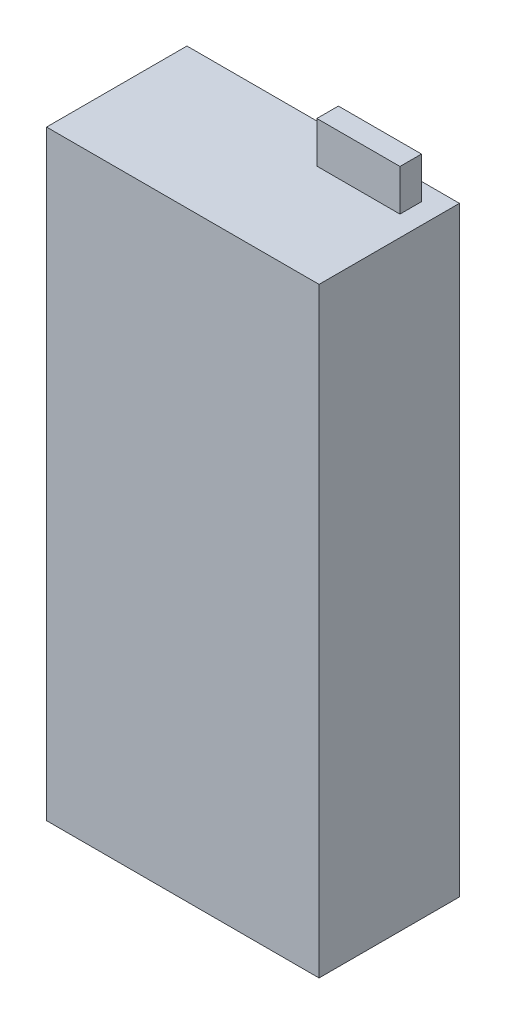
from build123d import *

# Parameters (mm, degrees)
SKETCH_1_W          = 132
SKETCH_1_H          = 291
EXTRUDE_1_DEPTH     = 68
SKETCH_2_R          = 2
CUT_EXTRUDE_1_DEPTH = 4
SKETCH_3_W          = 53.053280534
SKETCH_3_H          = 10.202175613
EXTRUDE_2_DEPTH     = 20
SKETCH_4_R          = 24.120605075
EXTRUDE_3_DEPTH     = 5
SKETCH_5_W          = 40.253809201
SKETCH_5_H          = 10.422389964
EXTRUDE_4_DEPTH     = 20


with BuildPart() as part:
    # 草图1 → 凸台-拉伸1 (new body)
    with BuildSketch(Plane.XY):
        with Locations((-127.074626866, 141.649253731)):
            Rectangle(SKETCH_1_W, SKETCH_1_H)
    extrude(amount=EXTRUDE_1_DEPTH)

    # 草图2 → 切除-拉伸1 (cut)
    with BuildSketch(Plane.ZY.offset(193.074626866)):
        with Locations(Location((17.5, 23.149253731, 0), (0, 0, 270))):
            Circle(SKETCH_2_R)
        with Locations(Location((55.5, 23.149253731, 0), (0, 0, 270))):
            Circle(SKETCH_2_R)
        with Locations(Location((55.5, 33.149253731, 0), (0, 0, 270))):
            Circle(SKETCH_2_R)
        with Locations(Location((17.5, 33.149253731, 0), (0, 0, 270))):
            Circle(SKETCH_2_R)
        with Locations(Location((17.5, 269.449253731, 0), (0, 0, 90))):
            Circle(SKETCH_2_R)
        with Locations(Location((17.5, 259.449253731, 0), (0, 0, 90))):
            Circle(SKETCH_2_R)
        with Locations(Location((55.5, 259.449253731, 0), (0, 0, 90))):
            Circle(SKETCH_2_R)
        with Locations(Location((55.5, 269.449253731, 0), (0, 0, 90))):
            Circle(SKETCH_2_R)
    extrude(amount=-CUT_EXTRUDE_1_DEPTH, mode=Mode.SUBTRACT)

    # 草图3 → 凸台-拉伸2 (add)
    with BuildSketch(Plane.XZ.offset(3.850746269)):
        with Locations((-152.07170966, 19.120276631)):
            Rectangle(SKETCH_3_W, SKETCH_3_H)
    extrude(amount=EXTRUDE_2_DEPTH)

    # 草图4 → 凸台-拉伸3 (add)
    with BuildSketch(Plane.XZ.offset(3.850746269)):
        with Locations(Location((-94.251857707, 37.587190062, 0), (0, 0, 90))):
            Circle(SKETCH_4_R)
    extrude(amount=EXTRUDE_3_DEPTH)

    # 草图5 → 凸台-拉伸4 (add)
    with BuildSketch(Plane(origin=(0, 287.149253731, 0), x_dir=(1, 0, 0), z_dir=(0, 1, 0))):
        with Locations((-91.075289647, -13.720381028)):
            Rectangle(SKETCH_5_W, SKETCH_5_H)
    extrude(amount=EXTRUDE_4_DEPTH)


solid = part.part
